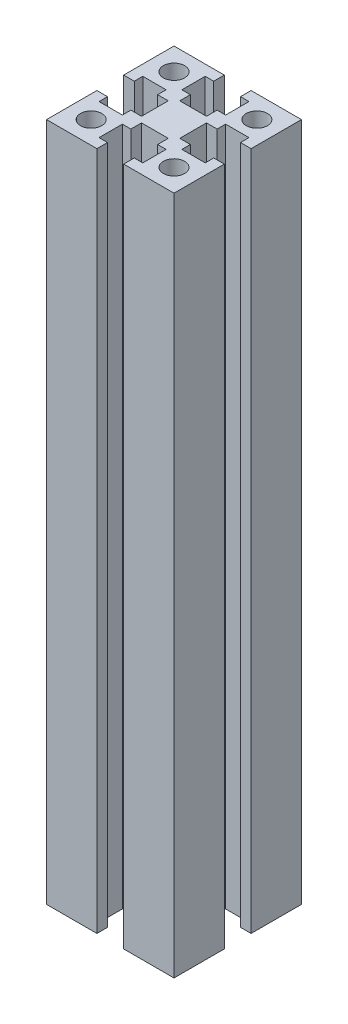
from build123d import *

# Parameters (mm, degrees)
SKETCH_1_R          = 2.5
EXTRUDE_1_DEPTH     = 180
SKETCH_2_R          = 82.250528809
CUT_EXTRUDE_1_DEPTH = 10
SKETCH_3_R          = 47.359827943
CUT_EXTRUDE_2_DEPTH = 200
SKETCH_4_R          = 50.055938799
CUT_EXTRUDE_3_DEPTH = 30
SKETCH_5_R          = 35.776746529
CUT_EXTRUDE_4_DEPTH = 40
SKETCH_1_3_R        = 2.5
EXTRUDE_2_DEPTH     = 200
SKETCH_6_R          = 45.508426161
CUT_EXTRUDE_5_DEPTH = 50
SKETCH_7_R          = 85.251485325
CUT_EXTRUDE_7_DEPTH = 20
SKETCH_1_5_R        = 2.5
EXTRUDE_3_DEPTH     = 160


with BuildPart() as part:
    # 草图1 → 凸台-拉伸1 (new, symmetric)
    with BuildSketch(Plane(origin=(0, 0, 0), x_dir=(1, 0, 0), z_dir=(0, 1, 0))):
        Polygon((-15, -3.15), (-12.5, -3.15), (-12.5, -5.15), (-7, -5.15), (-7, -3.15), (-4.5, -3.15), (-4.5, 3.15), (-7, 3.15), (-7, 5.15), (-12.5, 5.15), (-12.5, 3.15), (-15, 3.15), (-15, 15), (-3.15, 15), (-3.15, 12.5), (-5.15, 12.5), (-5.15, 7), (-3.15, 7), (-3.15, 4.5), (3.15, 4.5), (3.15, 7), (5.15, 7), (5.15, 12.5), (3.15, 12.5), (3.15, 15), (15, 15), (15, 3.15), (12.5, 3.15), (12.5, 5.15), (7, 5.15), (7, 3.15), (4.5, 3.15), (4.5, -3.15), (7, -3.15), (7, -5.15), (12.5, -5.15), (12.5, -3.15), (15, -3.15), (15, -15), (3.15, -15), (3.15, -12.5), (5.15, -12.5), (5.15, -7), (3.15, -7), (3.15, -4.5), (-3.15, -4.5), (-3.15, -7), (-5.15, -7), (-5.15, -12.5), (-3.15, -12.5), (-3.15, -15), (-15, -15), align=None)
        with Locations(Location((-9.75, -9.75, 0), (0, 0, 90))):
            Circle(SKETCH_1_R, mode=Mode.SUBTRACT)
        with Locations(Location((-9.75, 9.75, 0), (0, 0, 90))):
            Circle(SKETCH_1_R, mode=Mode.SUBTRACT)
        with Locations(Location((9.75, 9.75, 0), (0, 0, 90))):
            Circle(SKETCH_1_R, mode=Mode.SUBTRACT)
        with Locations(Location((9.75, -9.75, 0), (0, 0, 90))):
            Circle(SKETCH_1_R, mode=Mode.SUBTRACT)
    extrude(amount=EXTRUDE_1_DEPTH, both=True)

    # 草图2 → 切除-拉伸1 (cut)
    with BuildSketch(Plane(origin=(0, 180, 0), x_dir=(1, 0, 0), z_dir=(0, 1, 0))):
        Circle(SKETCH_2_R)
    extrude(amount=-CUT_EXTRUDE_1_DEPTH, mode=Mode.SUBTRACT)

    # 草图3 → 切除-拉伸2 (cut)
    with BuildSketch(Plane.XZ.offset(180)):
        with Locations((0.216432031, -1.772037256)):
            Circle(SKETCH_3_R)
    extrude(amount=-CUT_EXTRUDE_2_DEPTH, mode=Mode.SUBTRACT)

    # 草图4 → 切除-拉伸3 (cut)
    with BuildSketch(Plane.XZ.offset(-20)):
        with Locations((-1.287426062, -1.543634952)):
            Circle(SKETCH_4_R)
    extrude(amount=-CUT_EXTRUDE_3_DEPTH, mode=Mode.SUBTRACT)

    # 草图5 → 切除-拉伸4 (cut)
    with BuildSketch(Plane.XZ.offset(-50)):
        with Locations((-0.979370242, 0.864150214)):
            Circle(SKETCH_5_R)
    extrude(amount=-CUT_EXTRUDE_4_DEPTH, mode=Mode.SUBTRACT)

    # 草图1<3> → 凸台-拉伸2 (add)
    with BuildSketch(Plane(origin=(0, 0, 0), x_dir=(1, 0, 0), z_dir=(0, 1, 0))):
        Polygon((-15, -3.15), (-12.5, -3.15), (-12.5, -5.15), (-7, -5.15), (-7, -3.15), (-4.5, -3.15), (-4.5, 3.15), (-7, 3.15), (-7, 5.15), (-12.5, 5.15), (-12.5, 3.15), (-15, 3.15), (-15, 15), (-3.15, 15), (-3.15, 12.5), (-5.15, 12.5), (-5.15, 7), (-3.15, 7), (-3.15, 4.5), (3.15, 4.5), (3.15, 7), (5.15, 7), (5.15, 12.5), (3.15, 12.5), (3.15, 15), (15, 15), (15, 3.15), (12.5, 3.15), (12.5, 5.15), (7, 5.15), (7, 3.15), (4.5, 3.15), (4.5, -3.15), (7, -3.15), (7, -5.15), (12.5, -5.15), (12.5, -3.15), (15, -3.15), (15, -15), (3.15, -15), (3.15, -12.5), (5.15, -12.5), (5.15, -7), (3.15, -7), (3.15, -4.5), (-3.15, -4.5), (-3.15, -7), (-5.15, -7), (-5.15, -12.5), (-3.15, -12.5), (-3.15, -15), (-15, -15), align=None)
        with Locations(Location((-9.75, -9.75, 0), (0, 0, 90))):
            Circle(SKETCH_1_3_R, mode=Mode.SUBTRACT)
        with Locations(Location((-9.75, 9.75, 0), (0, 0, 90))):
            Circle(SKETCH_1_3_R, mode=Mode.SUBTRACT)
        with Locations(Location((9.75, 9.75, 0), (0, 0, 90))):
            Circle(SKETCH_1_3_R, mode=Mode.SUBTRACT)
        with Locations(Location((9.75, -9.75, 0), (0, 0, 90))):
            Circle(SKETCH_1_3_R, mode=Mode.SUBTRACT)
    extrude(amount=EXTRUDE_2_DEPTH)

    # 草图6 → 切除-拉伸5 (cut)
    with BuildSketch(Plane(origin=(0, 200, 0), x_dir=(1, 0, 0), z_dir=(0, 1, 0))):
        with Locations((-0.666782572, 0.500086929)):
            Circle(SKETCH_6_R)
    extrude(amount=-CUT_EXTRUDE_5_DEPTH, mode=Mode.SUBTRACT)

    # 草图7 → 切除-拉伸7 (cut)
    with BuildSketch(Plane(origin=(0, 150, 0), x_dir=(1, 0, 0), z_dir=(0, 1, 0))):
        with Locations((0, -1.241240206)):
            Circle(SKETCH_7_R)
    extrude(amount=-CUT_EXTRUDE_7_DEPTH, mode=Mode.SUBTRACT)

    # 草图1<5> → 凸台-拉伸3 (add)
    with BuildSketch(Plane(origin=(0, 0, 0), x_dir=(1, 0, 0), z_dir=(0, 1, 0))):
        Polygon((-15, -3.15), (-12.5, -3.15), (-12.5, -5.15), (-7, -5.15), (-7, -3.15), (-4.5, -3.15), (-4.5, 3.15), (-7, 3.15), (-7, 5.15), (-12.5, 5.15), (-12.5, 3.15), (-15, 3.15), (-15, 15), (-3.15, 15), (-3.15, 12.5), (-5.15, 12.5), (-5.15, 7), (-3.15, 7), (-3.15, 4.5), (3.15, 4.5), (3.15, 7), (5.15, 7), (5.15, 12.5), (3.15, 12.5), (3.15, 15), (15, 15), (15, 3.15), (12.5, 3.15), (12.5, 5.15), (7, 5.15), (7, 3.15), (4.5, 3.15), (4.5, -3.15), (7, -3.15), (7, -5.15), (12.5, -5.15), (12.5, -3.15), (15, -3.15), (15, -15), (3.15, -15), (3.15, -12.5), (5.15, -12.5), (5.15, -7), (3.15, -7), (3.15, -4.5), (-3.15, -4.5), (-3.15, -7), (-5.15, -7), (-5.15, -12.5), (-3.15, -12.5), (-3.15, -15), (-15, -15), align=None)
        with Locations(Location((-9.75, -9.75, 0), (0, 0, 90))):
            Circle(SKETCH_1_5_R, mode=Mode.SUBTRACT)
        with Locations(Location((-9.75, 9.75, 0), (0, 0, 90))):
            Circle(SKETCH_1_5_R, mode=Mode.SUBTRACT)
        with Locations(Location((9.75, 9.75, 0), (0, 0, 90))):
            Circle(SKETCH_1_5_R, mode=Mode.SUBTRACT)
        with Locations(Location((9.75, -9.75, 0), (0, 0, 90))):
            Circle(SKETCH_1_5_R, mode=Mode.SUBTRACT)
    extrude(amount=EXTRUDE_3_DEPTH)


solid = part.part
